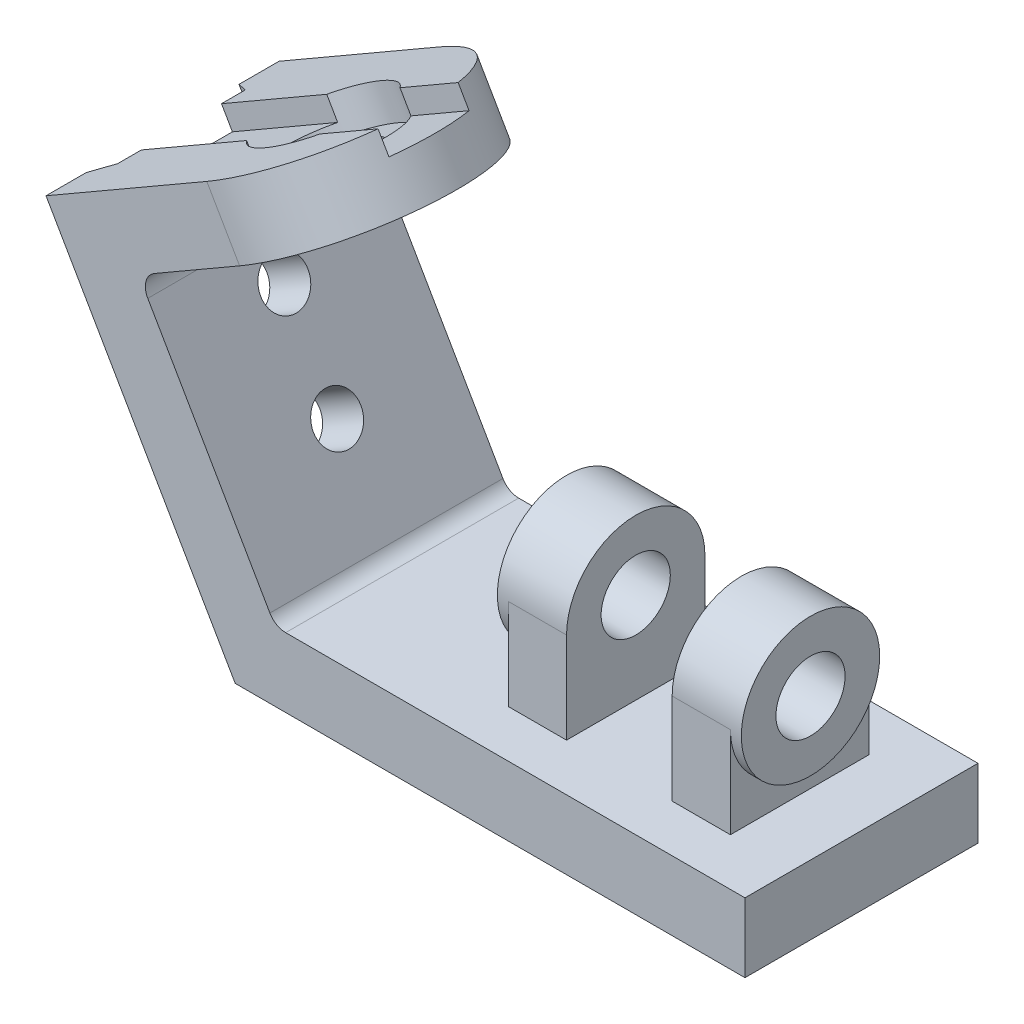
from build123d import *

# Parameters (mm, degrees)
CROQUIS1_W              = 140
CROQUIS1_H              = 64
SALIENTE_EXTRUIR1_DEPTH = 19
CROQUIS2_R              = 19
CROQUIS2_R_2            = 9.5
SALIENTE_EXTRUIR2_DEPTH = 19
SALIENTE_EXTRUIR3_DEPTH = 16
CROQUIS5_R              = 19
CROQUIS5_R_2            = 9.5
SALIENTE_EXTRUIR4_DEPTH = 19
SALIENTE_EXTRUIR5_START = -16
SALIENTE_EXTRUIR5_DEPTH = 16
SALIENTE_EXTRUIR6_DEPTH = 64
SALIENTE_EXTRUIR9_DEPTH = 18
CROQUIS14_R             = 16
CORTAR_EXTRUIR1_DEPTH   = 9
CROQUIS16_R             = 9.5
CORTAR_EXTRUIR2_DEPTH   = 19
CORTAR_EXTRUIR3_DEPTH   = 6
CORTAR_EXTRUIR4_DEPTH   = 187.944448389
CROQUIS19_R             = 6.5
CORTAR_EXTRUIR5_DEPTH   = 200.23943884
REDONDEO1_R             = 5


with BuildPart() as part:
    # Croquis1 → Saliente-Extruir1 (new body)
    with BuildSketch(Plane(origin=(0, 0, 0), x_dir=(1, 0, 0), z_dir=(0, 1, 0))):
        Rectangle(CROQUIS1_W, CROQUIS1_H)
    extrude(amount=SALIENTE_EXTRUIR1_DEPTH)



with BuildPart() as body_2:
    # Croquis2 → Saliente-Extruir2 (new body)
    with BuildSketch(Plane(origin=(37, 0, 0), x_dir=(0, 0, -1), z_dir=(1, 0, 0))):
        with Locations((0, 44)):
            Circle(CROQUIS2_R)
        with Locations((0, 44)):
            Circle(CROQUIS2_R_2, mode=Mode.SUBTRACT)
    extrude(amount=SALIENTE_EXTRUIR2_DEPTH)


with BuildPart() as part_1:
    add(part.part)

    add(body_2.part)  # Saliente-Extruir3 merges body 2
    # Croquis4 → Saliente-Extruir3 (add)
    with BuildSketch(Plane(origin=(37, 0, 0), x_dir=(0, 0, -1), z_dir=(1, 0, 0))):
        with BuildLine():
            ThreePointArc((19, 44), (0, 25), (-19, 44))
            Line((-19, 44), (-19, 19))
            Line((-19, 19), (19, 19))
            Line((19, 19), (19, 44))
        make_face()
    extrude(amount=SALIENTE_EXTRUIR3_DEPTH)



with BuildPart() as body_2_2:
    # Croquis5 → Saliente-Extruir4 (new body)
    with BuildSketch(Plane(origin=(8, 0, 0), x_dir=(0, 0, -1), z_dir=(1, 0, 0))):
        with Locations((0, 44)):
            Circle(CROQUIS5_R)
        with Locations((0, 44)):
            Circle(CROQUIS5_R_2, mode=Mode.SUBTRACT)
    extrude(amount=-SALIENTE_EXTRUIR4_DEPTH)


with BuildPart() as part_2:
    add(part_1.part)

    add(body_2_2.part)  # Saliente-Extruir5 merges body 2 2
    # Croquis6 → Saliente-Extruir5 (add)
    with BuildSketch(Plane(origin=(8, 0, 0), x_dir=(0, 0, -1), z_dir=(1, 0, 0)).offset(SALIENTE_EXTRUIR5_START)):
        with BuildLine():
            Line((19, 19), (19, 44))
            ThreePointArc((19, 44), (0, 25), (-19, 44))
            Line((-19, 44), (-19, 19))
            Line((-19, 19), (19, 19))
        make_face()
    extrude(amount=SALIENTE_EXTRUIR5_DEPTH)

    # Croquis7 → Saliente-Extruir6 (add)
    with BuildSketch(Plane.XY.offset(32)):
        Polygon((-70, 0), (-121.961524227, 90), (-105.507041555, 99.5), (-59.030344885, 19), (-70, 19), align=None)
    extrude(amount=-SALIENTE_EXTRUIR6_DEPTH)

    # Croquis9 → Saliente-Extruir9 (add)
    with BuildSketch(Plane(origin=(-69.461524227, 120.310889132, 0), x_dir=(0.8660254037844397, 0.4999999999999982, 0), z_dir=(-0.4999999999999983, 0.8660254037844398, 0))):
        with BuildLine():
            Line((-60.621778265, 32), (-9.621778265, 32))
            ThreePointArc((-9.621778265, 32), (22.378221735, 0), (-9.621778265, -32))
            Line((-9.621778265, -32), (-60.621778265, -32))
            Line((-60.621778265, -32), (-60.621778265, 32))
        make_face()
    extrude(amount=-SALIENTE_EXTRUIR9_DEPTH)

    # Croquis14 → Cortar-Extruir1 (cut)
    with BuildSketch(Plane(origin=(-69.461524227, 120.310889132, 0), x_dir=(0.8660254037844397, 0.4999999999999982, 0), z_dir=(-0.4999999999999983, 0.8660254037844398, 0))):
        with Locations(Location((-9.621778265, 0, 0), (0, 0, 180))):
            Circle(CROQUIS14_R)
    extrude(amount=-CORTAR_EXTRUIR1_DEPTH, mode=Mode.SUBTRACT)

    # Croquis16 → Cortar-Extruir2 (cut)
    with BuildSketch(Plane(origin=(-69.461524227, 120.310889132, 0), x_dir=(0.8660254037844397, 0.4999999999999982, 0), z_dir=(-0.4999999999999983, 0.8660254037844398, 0))):
        with Locations(Location((-9.621778265, 0, 0), (0, 0, 180))):
            Circle(CROQUIS16_R)
    extrude(amount=-CORTAR_EXTRUIR2_DEPTH, mode=Mode.SUBTRACT)

    # Croquis17 → Cortar-Extruir3 (cut)
    with BuildSketch(Plane(origin=(-69.461524227, 120.310889132, 0), x_dir=(0.8660254037844397, 0.4999999999999982, 0), z_dir=(-0.4999999999999983, 0.8660254037844398, 0))):
        with BuildLine():
            Line((-60.621778265, -11), (20.428180138, -11))
            ThreePointArc((20.428180138, -11), (22.378221735, 0), (20.428180138, 11))
            Line((20.428180138, 11), (-60.621778265, 11))
            Line((-60.621778265, 11), (-60.621778265, -11))
        make_face()
    extrude(amount=-CORTAR_EXTRUIR3_DEPTH, mode=Mode.SUBTRACT)

    # Croquis18 → Cortar-Extruir4 (cut, through all)
    with BuildSketch(Plane(origin=(-69.461524227, 120.310889132, 0), x_dir=(0.8660254037844397, 0.4999999999999982, 0), z_dir=(-0.4999999999999983, 0.8660254037844398, 0))):
        Polygon((-60.621778265, 21), (-54.621778265, 17.535898385), (-54.621778265, -17.535898385), (-60.621778265, -21), align=None)
    extrude(amount=-CORTAR_EXTRUIR4_DEPTH, mode=Mode.SUBTRACT)

    # Croquis19 → Cortar-Extruir5 (cut, through all)
    with BuildSketch(Plane(origin=(-47.303847577, -27.310889132, 0), x_dir=(0, 0, 1), z_dir=(-0.8660254037844396, -0.4999999999999983, 0))):
        with Locations(Location((0, 104.923048454, 0), (0, 0, 270))):
            Circle(CROQUIS19_R)
        with Locations(Location((0, 75.923048454, 0), (0, 0, 270))):
            Circle(CROQUIS19_R)
    extrude(amount=-CORTAR_EXTRUIR5_DEPTH, mode=Mode.SUBTRACT)

    # Redondeo1
    redondeo1_edges = [part_2.edges().sort_by_distance(p)[0] for p in [
        (-59.030344885, 19, 0),
        (-96.507041555, 83.911542732, 0),
    ]]
    fillet(redondeo1_edges, radius=REDONDEO1_R)


solid = part_2.part
